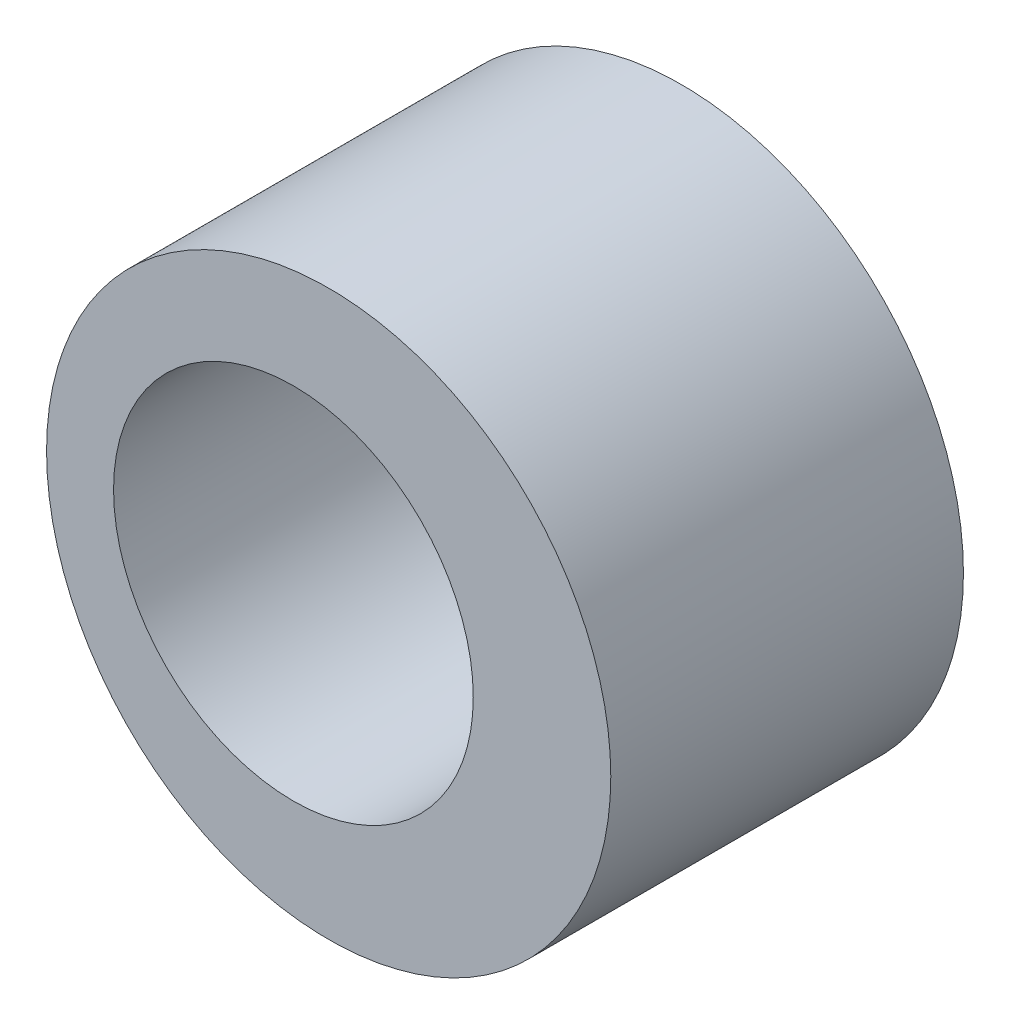
from build123d import *

# Parameters (mm, degrees)
SKETCH_1_R      = 4
SKETCH_1_R_2    = 2.55
EXTRUDE_1_DEPTH = 5


with BuildPart() as part:
    # 草图1 → 凸台-拉伸1 (new body)
    with BuildSketch(Plane.XY):
        Circle(SKETCH_1_R)
        with Locations((-0.5, 0)):
            Circle(SKETCH_1_R_2, mode=Mode.SUBTRACT)
    extrude(amount=EXTRUDE_1_DEPTH)


solid = part.part
